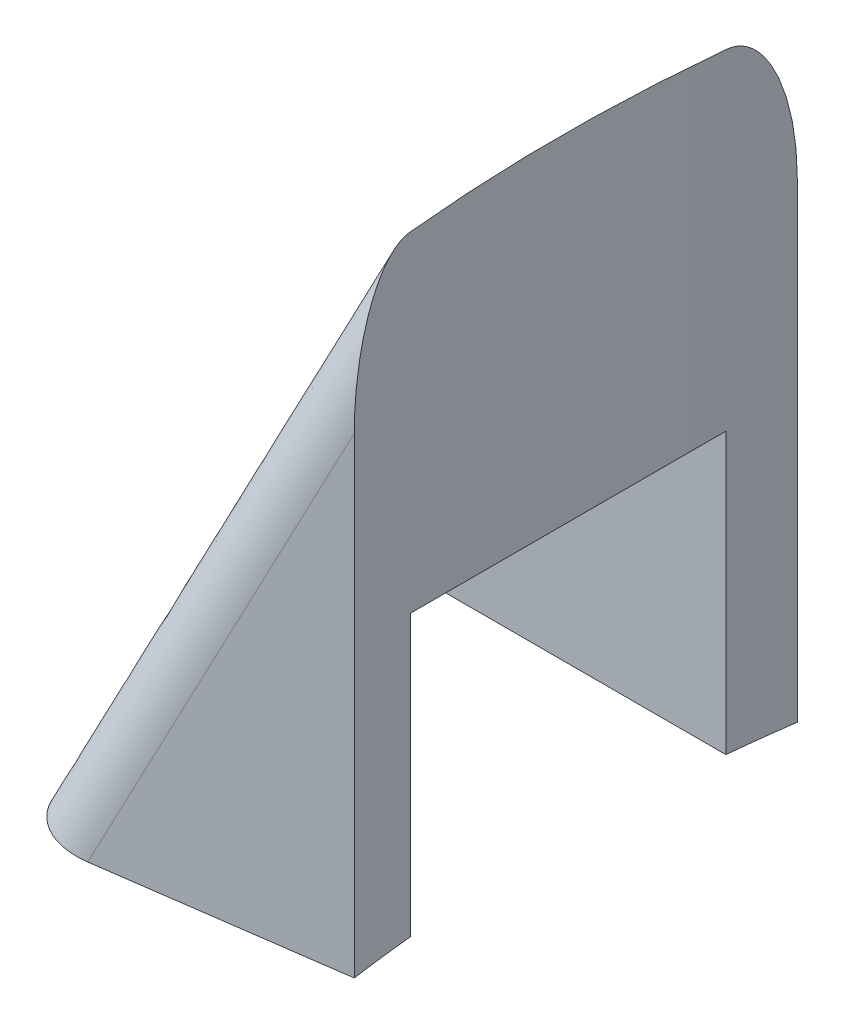
from build123d import *

# Parameters (mm, degrees)
REVOLVE1_ANGLE           = 8
REVOLVE1_OTHER_WAY_ANGLE = 8
CUT_EXTRUDE1_DEPTH       = 15.5
CUT_EXTRUDE1_DEPTH_BACK  = 15.5
FILLET1_R                = 6


with BuildPart() as part:
    # Sketch4 → Revolve1 (revolve)
    with BuildSketch(Plane.XY):
        Polygon((-156.4, 0), (-156.4, 60), (-186.4, 0), align=None)
    revolve(axis=Axis((0, 70, 0), (0, -1, 0)), revolution_arc=REVOLVE1_ANGLE)

    # Sketch4 → Revolve1 other way (revolve)
    with BuildSketch(Plane.XY):
        Polygon((-156.4, 0), (-156.4, 60), (-186.4, 0), align=None)
    revolve(axis=Axis((0, 70, 0), (0, 1, 0)), revolution_arc=REVOLVE1_OTHER_WAY_ANGLE)

    # Sketch6 → Cut-Extrude1 (cut, two sides: drawn at the far end of the back side and taken through both)
    with BuildSketch(Plane.XY.offset(-CUT_EXTRUDE1_DEPTH_BACK)):
        Polygon((-154.877925951, 28.284271247), (-183.162197199, 0), (-154.877925951, 0), align=None)
    extrude(amount=CUT_EXTRUDE1_DEPTH + CUT_EXTRUDE1_DEPTH_BACK, mode=Mode.SUBTRACT)

    # Fillet1
    fillet1_edges = [part.edges().sort_by_distance(p)[0] for p in [
        (-169.731946982, 30, 23.854269505),
        (-169.731946982, 30, -23.854269505),
    ]]
    fillet(fillet1_edges, radius=FILLET1_R)


solid = part.part
